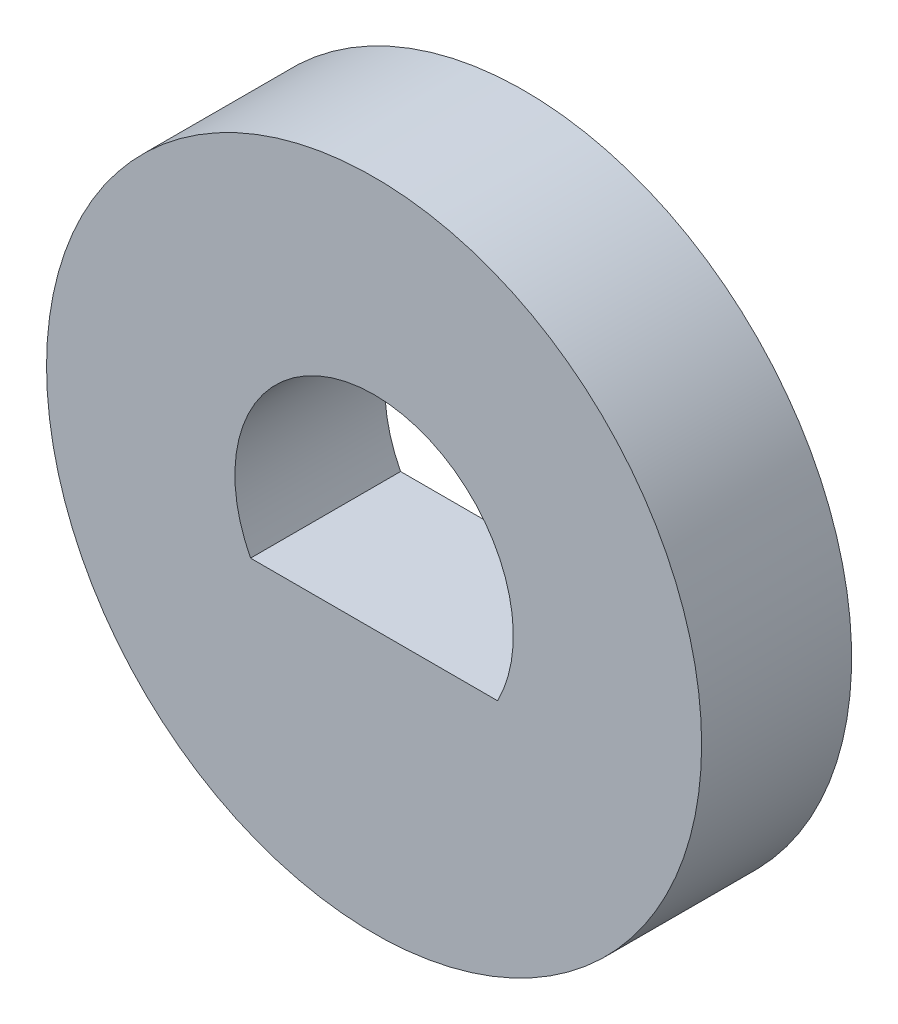
from build123d import *

# Parameters (mm, degrees)
SKETCH1_R           = 5
BOSS_EXTRUDE1_DEPTH = 2.29


with BuildPart() as part:
    # Sketch1 → Boss-Extrude1 (new body)
    with BuildSketch(Plane(origin=(0, 0, -27.433110106), x_dir=(-1, 0, 0), z_dir=(0, 0, -1))):
        Circle(SKETCH1_R)
        with BuildLine():
            Line((-1.885530429, -0.98), (1.885530429, -0.98))
            ThreePointArc((1.885530429, -0.98), (0, 2.125), (-1.885530429, -0.98))
        make_face(mode=Mode.SUBTRACT)
    extrude(amount=-BOSS_EXTRUDE1_DEPTH)


solid = part.part
